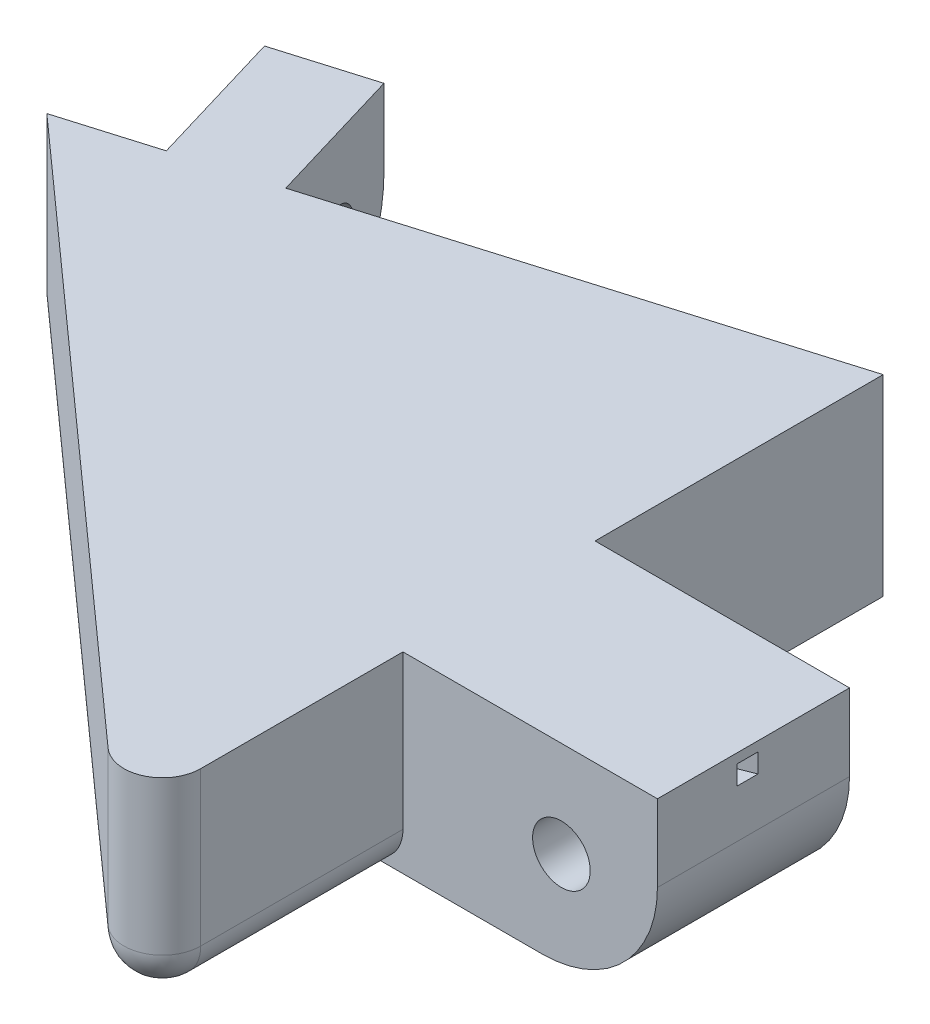
from build123d import *

# Parameters (mm, degrees)
SKETCH1_W           = 16.825477707
SKETCH1_H           = 12.7
BOSS_EXTRUDE1_DEPTH = 12.7
FILLET1_R           = 7.62
SKETCH2_R           = 1.905
CUT_EXTRUDE1_DEPTH  = 12.7
SKETCH3_W           = 6.35
SKETCH3_H           = 12.7
BOSS_EXTRUDE2_DEPTH = 9.652
FILLET2_R           = 7.62
SKETCH4_R           = 1.905
CUT_EXTRUDE2_DEPTH  = 12.7
FILLET3_R           = 2.54
SKETCH5_W           = 1.27
SKETCH5_H           = 1.27
FILLET4_R           = 2.54


with BuildPart() as part:
    # Sketch1 → Boss-Extrude1 (new body)
    with BuildSketch(Plane(origin=(0, 0, 0), x_dir=(1, 0, 0), z_dir=(0, 1, 0))):
        Polygon((-42.597094971, 9.46433121), (0, 22.16433121), (0, -28.63566879), align=None)
        with Locations((8.412738854, -3.23566879)):
            Rectangle(SKETCH1_W, SKETCH1_H)
    extrude(amount=BOSS_EXTRUDE1_DEPTH)

    # Fillet1
    fillet1_edges = [part.edges().sort_by_distance(p)[0] for p in [
        (16.825477707, 0, 3.23566879),
    ]]
    fillet(fillet1_edges, radius=FILLET1_R)

    # Sketch2 → Cut-Extrude1 (cut)
    with BuildSketch(Plane.XY.offset(9.58566879)):
        with Locations((10.475477707, 6.35)):
            Circle(SKETCH2_R)
    extrude(amount=-CUT_EXTRUDE1_DEPTH, mode=Mode.SUBTRACT)

    # Sketch3 → Boss-Extrude2 (add)
    with BuildSketch(Plane(origin=(-6.06868791, 0, -20.35499805), x_dir=(-0.9583148474999098, 0, 0.2857142857142858), z_dir=(-0.2857142857142858, 0, -0.9583148474999098))):
        with Locations((28.59233394, 6.35)):
            Rectangle(SKETCH3_W, SKETCH3_H)
    extrude(amount=BOSS_EXTRUDE2_DEPTH)

    # Fillet2
    fillet2_edges = [part.edges().sort_by_distance(p)[0] for p in [
        (-36.226860335, 0, -21.43541469),
    ]]
    fillet(fillet2_edges, radius=FILLET2_R)

    # Sketch4 → Cut-Extrude2 (cut)
    with BuildSketch(Plane(origin=(-30.44310778, 0, 9.076381126), x_dir=(0.2857142857142858, 0, 0.9583148474999098), z_dir=(-0.9583148474999098, 0, 0.2857142857142858))):
        with Locations((-26.066407684, 6.604)):
            Circle(SKETCH4_R)
    extrude(amount=-CUT_EXTRUDE2_DEPTH, mode=Mode.SUBTRACT)

    # Fillet3
    fillet3_edges = [part.edges().sort_by_distance(p)[0] for p in [
        (0, 6.35, 28.63566879),
    ]]
    fillet(fillet3_edges, radius=FILLET3_R)

    # Sketch5 → Cut-Revolve1 (revolve, cut)
    with BuildSketch(Plane(origin=(-8.826402195, 0, -29.604652958), x_dir=(-0.9583148474999099, 0, 0.28571428571428553), z_dir=(-0.28571428571428553, 0, -0.9583148474999099))):
        with Locations((28.59233394, 11.43)):
            Rectangle(SKETCH5_W, SKETCH5_H)
        with Locations((28.59233394, 1.27)):
            Rectangle(SKETCH5_W, SKETCH5_H)
    revolve(axis=Axis((1.537963556, 18.050379457, -32.694709807), (0, -1, 0)), mode=Mode.SUBTRACT)

    # Fillet4
    fillet4_edges = [part.edges().sort_by_distance(p)[0] for p in [
        (0, 0, 16.270862458),
        (-23.415214152, 0, 7.692464569),
        (-1.503049342, 0, 25.274748287),
    ]]
    fillet(fillet4_edges, radius=FILLET4_R)


solid = part.part
